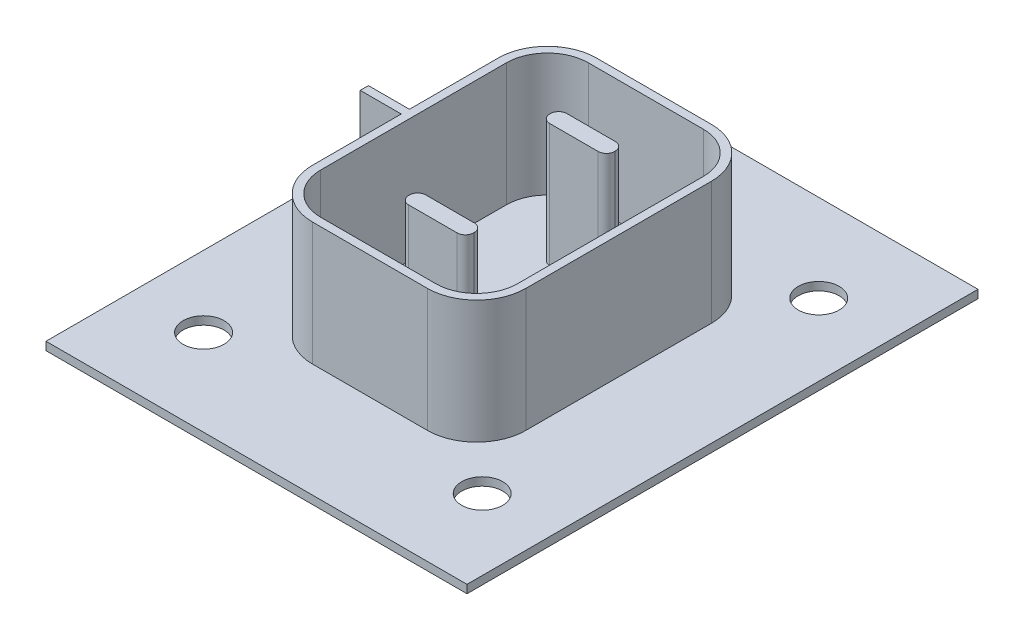
from build123d import *

# Parameters (mm, degrees)
EXTRUDE_1_DEPTH   = 30
EXTRUDE_1_2_DEPTH = 30
EXTRUDE_1_3_DEPTH = 30
SKETCH_2_W        = 102.668849522
SKETCH_2_H        = 124.613288396
SKETCH_2_R        = 5
EXTRUDE_2_DEPTH   = 2


with BuildPart() as part:
    # 草图1 → 凸台-拉伸1 (new body)
    with BuildSketch(Plane(origin=(0, 0, 0), x_dir=(1, 0, 0), z_dir=(0, 1, 0))):
        with BuildLine():
            ThreePointArc((-26.011198321, 22.633142138), (-22.496479695, 31.118423512), (-14.011198321, 34.633142138))
            Line((-14.011198321, 34.633142138), (14.011198321, 34.633142138))
            ThreePointArc((14.011198321, 34.633142138), (22.496479695, 31.118423512), (26.011198321, 22.633142138))
            Line((26.011198321, 22.633142138), (26.011198321, -22.633142138))
            ThreePointArc((26.011198321, -22.633142138), (22.496479695, -31.118423512), (14.011198321, -34.633142138))
            Line((14.011198321, -34.633142138), (-14.011198321, -34.633142138))
            ThreePointArc((-14.011198321, -34.633142138), (-22.496479695, -31.118423512), (-26.011198321, -22.633142138))
            Line((-26.011198321, -22.633142138), (-26.011198321, -1))
            Line((-26.011198321, -1), (-36.011198321, -1))
            Line((-36.011198321, -1), (-36.011198321, 1))
            Line((-36.011198321, 1), (-26.011198321, 1))
            Line((-26.011198321, 1), (-26.011198321, 22.633142138))
        make_face()
        with BuildLine():
            Line((-24.011198321, 22.633142138), (-24.011198321, -22.633142138))
            ThreePointArc((-24.011198321, -22.633142138), (-21.082266133, -29.70420995), (-14.011198321, -32.633142138))
            Line((-14.011198321, -32.633142138), (14.011198321, -32.633142138))
            ThreePointArc((14.011198321, -32.633142138), (21.082266133, -29.70420995), (24.011198321, -22.633142138))
            Line((24.011198321, -22.633142138), (24.011198321, 22.633142138))
            ThreePointArc((24.011198321, 22.633142138), (21.082266133, 29.70420995), (14.011198321, 32.633142138))
            Line((14.011198321, 32.633142138), (-14.011198321, 32.633142138))
            ThreePointArc((-14.011198321, 32.633142138), (-21.082266133, 29.70420995), (-24.011198321, 22.633142138))
        make_face(mode=Mode.SUBTRACT)
    extrude(amount=EXTRUDE_1_DEPTH)

    # 草图2 → 凸台-拉伸2 (add)
    with BuildSketch(Plane(origin=(0, 0, 0), x_dir=(1, 0, 0), z_dir=(0, 1, 0))):
        Rectangle(SKETCH_2_W, SKETCH_2_H)
        with Locations(Location((-33.977994318, -41.240450485, 0), (0, 0, 270))):
            Circle(SKETCH_2_R, mode=Mode.SUBTRACT)
        with Locations(Location((34.002429765, -41.270108764, 0), (0, 0, 270))):
            Circle(SKETCH_2_R, mode=Mode.SUBTRACT)
        with Locations(Location((33.788584472, 41.01055618, 0), (0, 0, 270))):
            Circle(SKETCH_2_R, mode=Mode.SUBTRACT)
        with Locations(Location((-33.591248628, 40.771041775, 0), (0, 0, 270))):
            Circle(SKETCH_2_R, mode=Mode.SUBTRACT)
    extrude(amount=-EXTRUDE_2_DEPTH)


with BuildPart() as body_2:
    # 草图1 → Extrude 1 2 (new body)
    with BuildSketch(Plane(origin=(0, 0, 0), x_dir=(1, 0, 0), z_dir=(0, 1, 0))):
        with BuildLine():
            ThreePointArc((5.908394367, 19.291424928), (7.322607929, 18.705638491), (7.908394367, 17.291424928))
            Line((7.908394367, 17.291424928), (7.908394367, 17.099147011))
            ThreePointArc((7.908394367, 17.099147011), (7.322607929, 15.684933449), (5.908394367, 15.099147011))
            Line((5.908394367, 15.099147011), (-5.908394367, 15.099147011))
            ThreePointArc((-5.908394367, 15.099147011), (-7.322607929, 15.684933449), (-7.908394367, 17.099147011))
            Line((-7.908394367, 17.099147011), (-7.908394367, 17.291424928))
            ThreePointArc((-7.908394367, 17.291424928), (-7.322607929, 18.705638491), (-5.908394367, 19.291424928))
            Line((-5.908394367, 19.291424928), (5.908394367, 19.291424928))
        make_face()
    extrude(amount=EXTRUDE_1_2_DEPTH)


with BuildPart() as body_3:
    # 草图1 → Extrude 1 3 (new body)
    with BuildSketch(Plane(origin=(0, 0, 0), x_dir=(1, 0, 0), z_dir=(0, 1, 0))):
        with BuildLine():
            Line((-7.908394367, -17.291424928), (-7.908394367, -17.099147011))
            ThreePointArc((-7.908394367, -17.099147011), (-7.322607929, -15.684933449), (-5.908394367, -15.099147011))
            Line((-5.908394367, -15.099147011), (5.908394367, -15.099147011))
            ThreePointArc((5.908394367, -15.099147011), (7.322607929, -15.684933449), (7.908394367, -17.099147011))
            Line((7.908394367, -17.099147011), (7.908394367, -17.291424928))
            ThreePointArc((7.908394367, -17.291424928), (7.322607929, -18.705638491), (5.908394367, -19.291424928))
            Line((5.908394367, -19.291424928), (-5.908394367, -19.291424928))
            ThreePointArc((-5.908394367, -19.291424928), (-7.322607929, -18.705638491), (-7.908394367, -17.291424928))
        make_face()
    extrude(amount=EXTRUDE_1_3_DEPTH)


solid = Compound([part.part, body_2.part, body_3.part])
